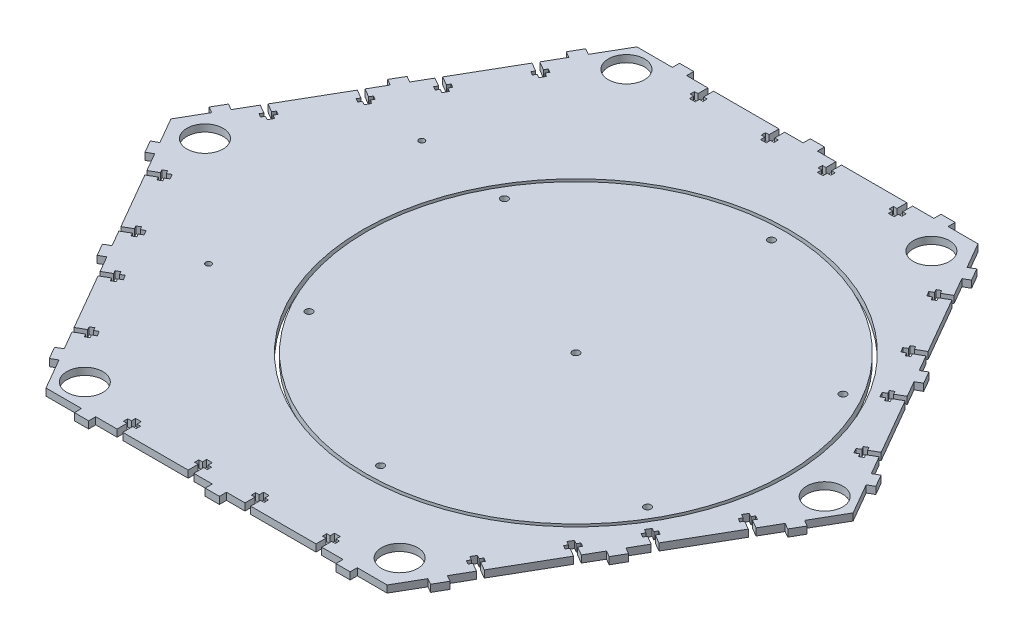
from build123d import *

# Parameters (mm, degrees)
CROQUIS1_R            = 12.7
CROQUIS1_R_2          = 2
CROQUIS1_R_3          = 150
BOSS_EXTRUDE1_DEPTH   = 5
CROQUIS1_R_4          = 147.5
CROQUIS1_R_5          = 2.5
BOSS_EXTRUDE1_2_DEPTH = 5


with BuildPart() as part:
    # Croquis1 → Boss-Extrude1 (new body)
    with BuildSketch(Plane(origin=(0, 0, 0), x_dir=(1, 0, 0), z_dir=(0, 1, 0))):
        Polygon((-95, 207.846096908), (-120, 207.846096908), (-132.5, 186.195461814), (-136.830127019, 188.695461814), (-141.830127019, 180.035207776), (-137.5, 177.535207776), (-145, 164.544826719), (-138.937822174, 161.044826719), (-137.687822174, 163.209890229), (-135.089745962, 161.709890229), (-136.339745962, 159.544826719), (-133.741669751, 158.044826719), (-135.741669751, 154.580725104), (-138.339745962, 156.080725104), (-139.589745962, 153.915661594), (-142.187822174, 155.415661594), (-140.937822174, 157.580725104), (-147, 161.080725104), (-170, 121.24355653), (-163.937822174, 117.74355653), (-162.687822174, 119.908620039), (-160.089745962, 118.408620039), (-161.339745962, 116.24355653), (-158.741669751, 114.74355653), (-160.741669751, 111.279454915), (-163.339745962, 112.779454915), (-164.589745962, 110.614391405), (-167.187822174, 112.114391405), (-165.937822174, 114.279454915), (-172, 117.779454915), (-178.5, 106.521124666), (-182.830127019, 109.021124666), (-187.830127019, 100.360870628), (-183.5, 97.860870628), (-190, 86.602540378), (-183.937822174, 83.102540378), (-182.687822174, 85.267603888), (-180.089745962, 83.767603888), (-181.339745962, 81.602540378), (-178.741669751, 80.102540378), (-180.729962904, 76.658715617), (-183.328039115, 78.158715617), (-184.578039115, 75.993652108), (-187.176115326, 77.493652108), (-185.926115326, 79.658715617), (-191.988293153, 83.158715617), (-214.988293153, 43.321547043), (-208.926115326, 39.821547043), (-207.676115326, 41.986610553), (-205.078039115, 40.486610553), (-206.328039115, 38.321547043), (-203.729962904, 36.821547043), (-205.729962904, 33.357445428), (-208.328039115, 34.857445428), (-209.578039115, 32.692381919), (-212.176115326, 34.192381919), (-210.926115326, 36.357445428), (-216.988293153, 39.857445428), (-224.488293153, 26.867064372), (-228.818420172, 29.367064372), (-233.818420172, 20.706810334), (-229.488293153, 18.206810334), (-240, 0), (-229.488293153, -18.206810334), (-233.818420172, -20.706810334), (-228.818420172, -29.367064371), (-224.488293153, -26.867064371), (-216.988293153, -39.857445428), (-210.926115326, -36.357445428), (-212.176115326, -34.192381919), (-209.578039115, -32.692381919), (-208.328039115, -34.857445428), (-205.729962904, -33.357445428), (-203.729962904, -36.821547043), (-206.328039115, -38.321547043), (-205.078039115, -40.486610553), (-207.676115326, -41.986610553), (-208.926115326, -39.821547043), (-214.988293153, -43.321547043), (-191.988293153, -83.158715617), (-185.926115326, -79.658715617), (-187.176115326, -77.493652108), (-184.578039115, -75.993652108), (-183.328039115, -78.158715617), (-180.729962904, -76.658715617), (-178.741669751, -80.102540378), (-181.339745962, -81.602540378), (-180.089745962, -83.767603888), (-182.687822174, -85.267603888), (-183.937822174, -83.102540378), (-190, -86.602540378), (-183.5, -97.860870628), (-187.830127019, -100.360870628), (-182.830127019, -109.021124665), (-178.5, -106.521124665), (-172, -117.779454915), (-165.937822174, -114.279454915), (-167.187822174, -112.114391405), (-164.589745962, -110.614391405), (-163.339745962, -112.779454915), (-160.741669751, -111.279454915), (-158.741669751, -114.74355653), (-161.339745962, -116.24355653), (-160.089745962, -118.408620039), (-162.687822174, -119.908620039), (-163.937822174, -117.74355653), (-170, -121.24355653), (-147, -161.080725104), (-140.937822174, -157.580725104), (-142.187822174, -155.415661594), (-139.589745962, -153.915661594), (-138.339745962, -156.080725104), (-135.741669751, -154.580725104), (-133.741669751, -158.044826719), (-136.339745962, -159.544826719), (-135.089745962, -161.709890228), (-137.687822174, -163.209890228), (-138.937822174, -161.044826719), (-145, -164.544826719), (-137.5, -177.535207776), (-141.830127019, -180.035207776), (-136.830127019, -188.695461814), (-132.5, -186.195461814), (-120, -207.846096908), (-95, -207.846096908), (-95, -212.846096908), (-85, -212.846096908), (-85, -207.846096908), (-70, -207.846096908), (-70, -200.846096908), (-72.5, -200.846096908), (-72.5, -197.846096908), (-70, -197.846096908), (-70, -194.846096908), (-66, -194.846096908), (-66, -197.846096908), (-63.5, -197.846096908), (-63.5, -200.846096908), (-66, -200.846096908), (-66, -207.846096908), (-20, -207.846096908), (-20, -200.846096908), (-22.5, -200.846096908), (-22.5, -197.846096908), (-20, -197.846096908), (-20, -194.846096908), (-16, -194.846096908), (-16, -197.846096908), (-13.5, -197.846096908), (-13.5, -200.846096908), (-16, -200.846096908), (-16, -207.846096908), (-3, -207.846096908), (-3, -212.846096908), (7, -212.846096908), (7, -207.846096908), (20, -207.846096908), (20, -200.846096908), (17.5, -200.846096908), (17.5, -197.846096908), (20, -197.846096908), (20, -194.846096908), (23.976586306, -194.846096908), (23.976586306, -197.846096908), (26.476586306, -197.846096908), (26.476586306, -200.846096908), (23.976586306, -200.846096908), (23.976586306, -207.846096908), (69.976586306, -207.846096908), (69.976586306, -200.846096908), (67.476586306, -200.846096908), (67.476586306, -197.846096908), (69.976586306, -197.846096908), (69.976586306, -194.846096908), (73.976586306, -194.846096908), (73.976586306, -197.846096908), (76.476586306, -197.846096908), (76.476586306, -200.846096908), (73.976586306, -200.846096908), (73.976586306, -207.846096908), (88.976586306, -207.846096908), (88.976586306, -212.846096908), (98.976586306, -212.846096908), (98.976586306, -207.846096908), (120, -207.846096908), (130.511706847, -189.639286575), (134.841833866, -192.139286575), (139.841833866, -183.479032537), (135.511706847, -180.979032537), (143.011706847, -167.98865148), (136.949529021, -164.48865148), (135.699529021, -166.653714989), (133.101452809, -165.153714989), (134.351452809, -162.98865148), (131.753376598, -161.48865148), (133.753376598, -158.024549865), (136.351452809, -159.524549865), (137.601452809, -157.359486355), (140.199529021, -158.859486355), (138.949529021, -161.024549865), (145.011706847, -164.524549865), (168.011706847, -124.687381291), (161.949529021, -121.187381291), (160.699529021, -123.3524448), (158.101452809, -121.8524448), (159.351452809, -119.687381291), (156.753376598, -118.187381291), (158.741669751, -114.74355653), (161.339745962, -116.24355653), (162.589745962, -114.07849302), (165.187822174, -115.57849302), (163.937822174, -117.74355653), (170, -121.24355653), (176.5, -109.985226281), (180.830127019, -112.485226281), (185.830127019, -103.824972243), (181.5, -101.324972243), (188, -90.066641994), (181.937822174, -86.566641994), (180.687822173, -88.731705503), (178.089745962, -87.231705503), (179.339745962, -85.066641994), (176.741669751, -83.566641994), (178.741669751, -80.102540378), (181.339745962, -81.602540378), (182.589745962, -79.437476869), (185.187822174, -80.937476869), (183.937822174, -83.102540378), (190, -86.602540378), (213, -46.765371804), (206.937822174, -43.265371804), (205.687822174, -45.430435314), (203.089745962, -43.930435314), (204.339745962, -41.765371804), (201.741669751, -40.265371804), (203.741669751, -36.801270189), (206.339745962, -38.301270189), (207.589745962, -36.13620668), (210.187822174, -37.63620668), (208.937822174, -39.801270189), (215, -43.301270189), (222.5, -30.310889132), (226.830127019, -32.810889132), (231.830127019, -24.150635095), (227.5, -21.650635095), (240, 0), (227.5, 21.650635095), (231.830127019, 24.150635095), (226.830127019, 32.810889132), (222.5, 30.310889132), (215, 43.301270189), (208.937822174, 39.801270189), (210.187822174, 37.63620668), (207.589745962, 36.13620668), (206.339745962, 38.301270189), (203.741669751, 36.801270189), (201.741669751, 40.265371804), (204.339745962, 41.765371804), (203.089745962, 43.930435314), (205.687822174, 45.430435314), (206.937822174, 43.265371804), (213, 46.765371804), (190, 86.602540378), (183.937822174, 83.102540378), (185.187822174, 80.937476869), (182.589745962, 79.437476869), (181.339745962, 81.602540378), (178.741669751, 80.102540378), (176.741669751, 83.566641994), (179.339745962, 85.066641994), (178.089745962, 87.231705503), (180.687822174, 88.731705503), (181.937822174, 86.566641994), (188, 90.066641994), (181.5, 101.324972243), (185.830127019, 103.824972243), (180.830127019, 112.485226281), (176.5, 109.985226281), (170, 121.24355653), (163.937822174, 117.74355653), (165.187822174, 115.57849302), (162.589745962, 114.07849302), (161.339745962, 116.24355653), (158.741669751, 114.74355653), (156.753376598, 118.187381291), (159.351452809, 119.687381291), (158.101452809, 121.8524448), (160.699529021, 123.3524448), (161.949529021, 121.187381291), (168.011706847, 124.687381291), (145.011706847, 164.524549865), (138.949529021, 161.024549865), (140.199529021, 158.859486355), (137.601452809, 157.359486355), (136.351452809, 159.524549865), (133.753376598, 158.024549865), (131.753376598, 161.48865148), (134.351452809, 162.98865148), (133.101452809, 165.153714989), (135.699529021, 166.653714989), (136.949529021, 164.48865148), (143.011706847, 167.98865148), (135.511706847, 180.979032537), (139.841833866, 183.479032537), (134.841833866, 192.139286575), (130.511706847, 189.639286575), (120, 207.846096908), (98.976586306, 207.846096908), (98.976586306, 212.846096908), (88.976586306, 212.846096908), (88.976586306, 207.846096908), (73.976586306, 207.846096908), (73.976586306, 200.846096908), (76.476586306, 200.846096908), (76.476586306, 197.846096908), (73.976586306, 197.846096908), (73.976586306, 194.846096908), (69.976586306, 194.846096908), (69.976586306, 197.846096908), (67.476586306, 197.846096908), (67.476586306, 200.846096908), (69.976586306, 200.846096908), (69.976586306, 207.846096908), (23.976586306, 207.846096908), (23.976586306, 200.846096908), (26.476586306, 200.846096908), (26.476586306, 197.846096908), (23.976586306, 197.846096908), (23.976586306, 194.846096908), (20, 194.846096908), (20, 197.846096908), (17.5, 197.846096908), (17.5, 200.846096908), (20, 200.846096908), (20, 207.846096908), (7, 207.846096908), (7, 212.846096908), (-3, 212.846096908), (-3, 207.846096908), (-16, 207.846096908), (-16, 200.846096908), (-13.5, 200.846096908), (-13.5, 197.846096908), (-16, 197.846096908), (-16, 194.846096908), (-20, 194.846096908), (-20, 197.846096908), (-22.5, 197.846096908), (-22.5, 200.846096908), (-20, 200.846096908), (-20, 207.846096908), (-66, 207.846096908), (-66, 200.846096908), (-63.5, 200.846096908), (-63.5, 197.846096908), (-66, 197.846096908), (-66, 194.846096908), (-70, 194.846096908), (-70, 197.846096908), (-72.5, 197.846096908), (-72.5, 200.846096908), (-70, 200.846096908), (-70, 207.846096908), (-85, 207.846096908), (-85, 212.846096908), (-95, 212.846096908), align=None)
        with Locations((-110, -190.525588833)):
            Circle(CROQUIS1_R, mode=Mode.SUBTRACT)
        with Locations((-138.475208614, -75)):
            Circle(CROQUIS1_R_2, mode=Mode.SUBTRACT)
        with Locations((-216, 0)):
            Circle(CROQUIS1_R, mode=Mode.SUBTRACT)
        with Locations((108, -187.061487217)):
            Circle(CROQUIS1_R, mode=Mode.SUBTRACT)
        with Locations((45, 0)):
            Circle(CROQUIS1_R_3, mode=Mode.SUBTRACT)
        with Locations((220, 0)):
            Circle(CROQUIS1_R, mode=Mode.SUBTRACT)
        with Locations((-138.475208614, 75)):
            Circle(CROQUIS1_R_2, mode=Mode.SUBTRACT)
        with Locations((-110, 190.525588833)):
            Circle(CROQUIS1_R, mode=Mode.SUBTRACT)
        with Locations((108, 187.061487217)):
            Circle(CROQUIS1_R, mode=Mode.SUBTRACT)
    extrude(amount=BOSS_EXTRUDE1_DEPTH)


with BuildPart() as body_2:
    # Croquis1 → Boss-Extrude1 2 (new body)
    with BuildSketch(Plane(origin=(0, 0, 0), x_dir=(1, 0, 0), z_dir=(0, 1, 0))):
        with Locations((45, 0)):
            Circle(CROQUIS1_R_4)
        with Locations((-74.07849302, -68.75)):
            Circle(CROQUIS1_R_5, mode=Mode.SUBTRACT)
        with Locations((45, -137.5)):
            Circle(CROQUIS1_R_5, mode=Mode.SUBTRACT)
        with Locations((45, 0)):
            Circle(CROQUIS1_R_5, mode=Mode.SUBTRACT)
        with Locations((164.07849302, -68.75)):
            Circle(CROQUIS1_R_5, mode=Mode.SUBTRACT)
        with Locations((-74.07849302, 68.75)):
            Circle(CROQUIS1_R_5, mode=Mode.SUBTRACT)
        with Locations((164.07849302, 68.75)):
            Circle(CROQUIS1_R_5, mode=Mode.SUBTRACT)
        with Locations((45, 137.5)):
            Circle(CROQUIS1_R_5, mode=Mode.SUBTRACT)
    extrude(amount=BOSS_EXTRUDE1_2_DEPTH)


solid = Compound([part.part, body_2.part])
